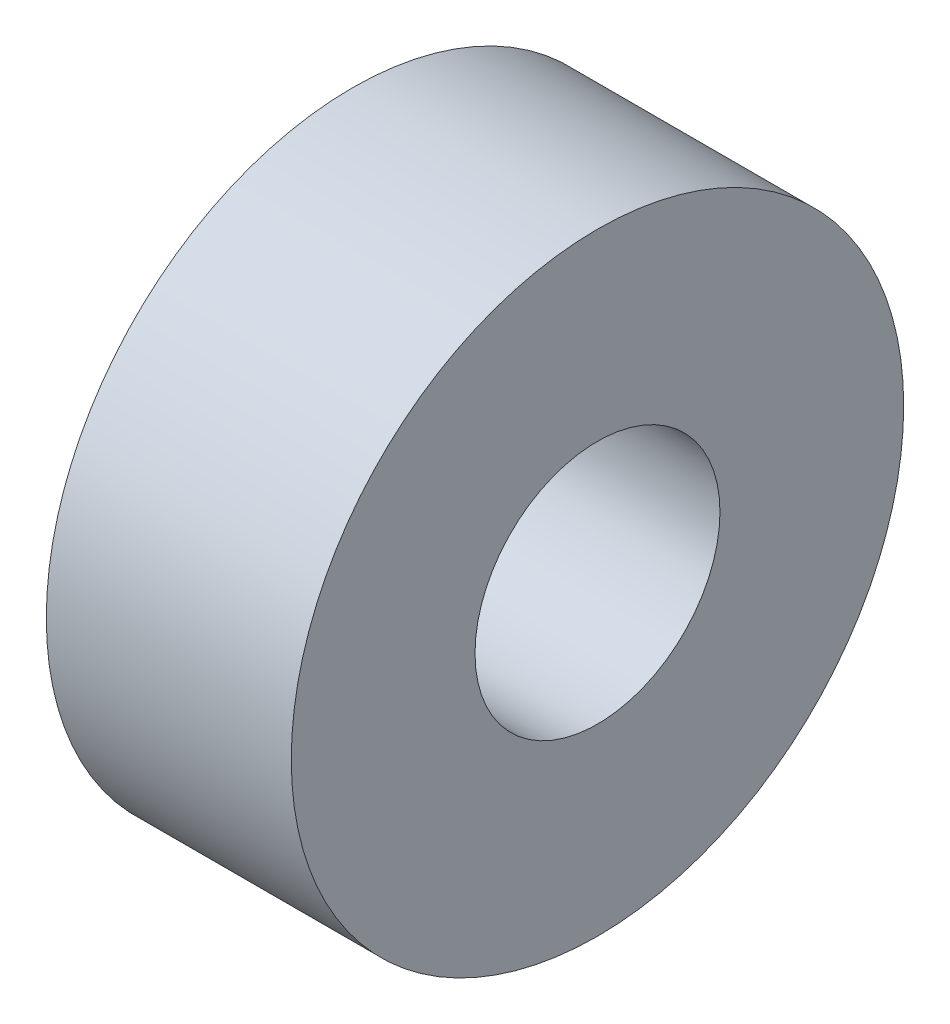
from build123d import *

# Parameters (mm, degrees)
SKETCH1_W = 10
SKETCH1_H = 7.5


with BuildPart() as part:
    # Sketch1 → Revolve1 (revolve)
    with BuildSketch(Plane.XY, mode=Mode.PRIVATE) as revolve1_sk:
        with Locations((8, 8.75)):
            Rectangle(SKETCH1_W, SKETCH1_H)
    revolve(revolve1_sk.sketch.rotate(Axis((0, 0, 0), (1, 0, 0)), 90), axis=Axis((0, 0, 0), (1, 0, 0)))


solid = part.part
